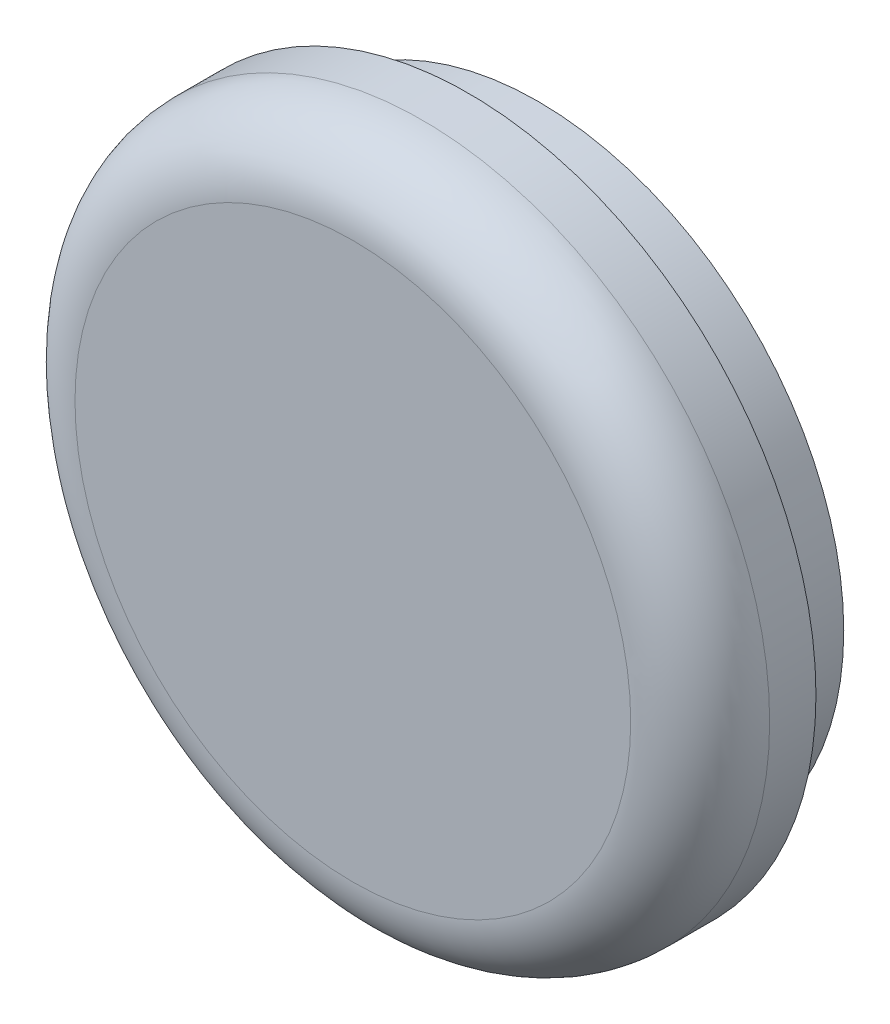
from build123d import *

# Parameters (mm, degrees)
SKETCH1_R           = 15
BOSS_EXTRUDE1_DEPTH = 5
FILLET1_R           = 3
SKETCH2_R           = 12
CUT_EXTRUDE1_DEPTH  = 3.5
FILLET2_R           = 3
SKETCH4_R           = 13.2
BOSS_EXTRUDE3_DEPTH = 3
SKETCH5_R           = 12
CUT_EXTRUDE2_DEPTH  = 3


with BuildPart() as part:
    # Sketch1 → Boss-Extrude1 (new body)
    with BuildSketch(Plane.XY):
        Circle(SKETCH1_R)
    extrude(amount=BOSS_EXTRUDE1_DEPTH)

    # Fillet1
    fillet1_edges = [part.edges().sort_by_distance(p)[0] for p in [
        (-15, 0, 5),
    ]]
    fillet(fillet1_edges, radius=FILLET1_R)

    # Sketch2 → Cut-Extrude1 (cut)
    with BuildSketch(Plane(origin=(0, 0, 0), x_dir=(-1, 0, 0), z_dir=(0, 0, -1))):
        Circle(SKETCH2_R)
    extrude(amount=-CUT_EXTRUDE1_DEPTH, mode=Mode.SUBTRACT)

    # Fillet2
    fillet2_edges = [part.edges().sort_by_distance(p)[0] for p in [
        (12, 0, 3.5),
    ]]
    fillet(fillet2_edges, radius=FILLET2_R)

    # Sketch4 → Boss-Extrude3 (add)
    with BuildSketch(Plane(origin=(0, 0, 0), x_dir=(-1, 0, 0), z_dir=(0, 0, -1))):
        Circle(SKETCH4_R)
    extrude(amount=BOSS_EXTRUDE3_DEPTH)

    # Sketch5 → Cut-Extrude2 (cut)
    with BuildSketch(Plane(origin=(0, 0, -3), x_dir=(-1, 0, 0), z_dir=(0, 0, -1))):
        Circle(SKETCH5_R)
    extrude(amount=-CUT_EXTRUDE2_DEPTH, mode=Mode.SUBTRACT)


solid = part.part
